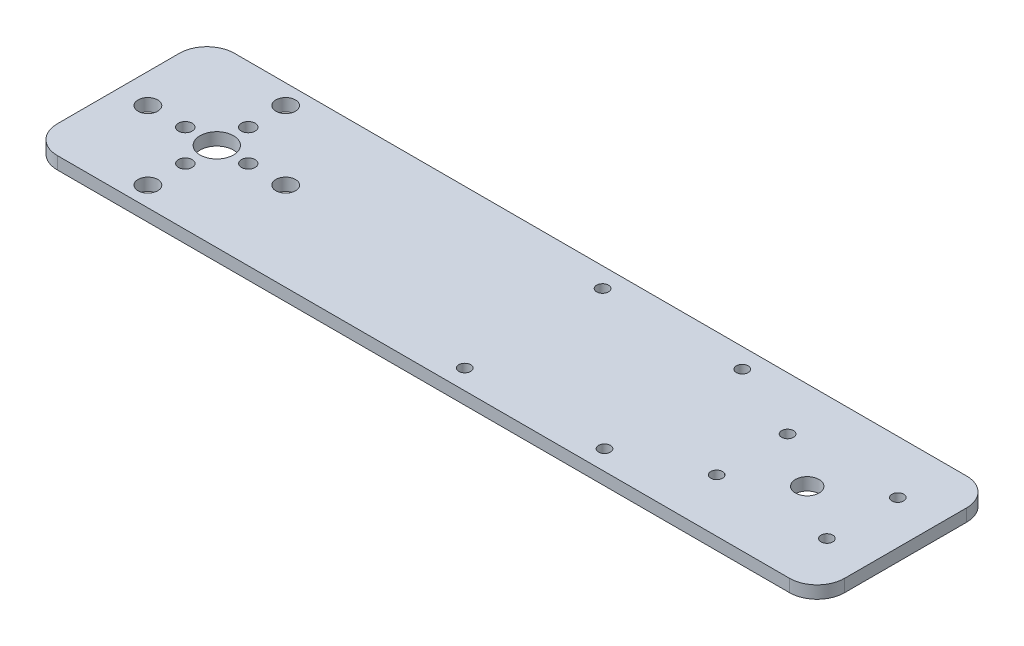
from build123d import *

# Parameters (mm, degrees)
SKETCH1_W           = 200
SKETCH1_H           = 45
BOSS_EXTRUDE1_DEPTH = 3.175
SKETCH4_R           = 3
SKETCH4_R_2         = 1.5
CUT_EXTRUDE1_DEPTH  = 177.469064215
SKETCH5_R           = 4.25
CUT_EXTRUDE2_DEPTH  = 177.469064215
SKETCH10_R          = 1.5
CUT_EXTRUDE4_DEPTH  = 177.469064215
FILLET1_R           = 7
SKETCH11_R          = 2.5
CUT_EXTRUDE5_DEPTH  = 177.469064215
SKETCH12_R          = 1.75
CUT_EXTRUDE6_DEPTH  = 177.469064215


with BuildPart() as part:
    # Sketch1 → Boss-Extrude1 (new body)
    with BuildSketch(Plane(origin=(0, 0, 0), x_dir=(1, 0, 0), z_dir=(0, 1, 0))):
        with Locations((75, 0)):
            Rectangle(SKETCH1_W, SKETCH1_H)
    extrude(amount=BOSS_EXTRUDE1_DEPTH)

    # Sketch4 → Cut-Extrude1 (cut, through all)
    with BuildSketch(Plane(origin=(0, 3.175, 0), x_dir=(1, 0, 0), z_dir=(0, 1, 0))):
        with Locations(Location((150, 0, 0), (0, 0, 270))):
            Circle(SKETCH4_R)
        with Locations(Location((136, 9, 0), (0, 0, 270))):
            Circle(SKETCH4_R_2)
        with Locations(Location((164, 9, 0), (0, 0, 90))):
            Circle(SKETCH4_R_2)
        with Locations(Location((164, -9, 0), (0, 0, 270))):
            Circle(SKETCH4_R_2)
        with Locations(Location((136, -9, 0), (0, 0, 90))):
            Circle(SKETCH4_R_2)
    extrude(amount=-CUT_EXTRUDE1_DEPTH, mode=Mode.SUBTRACT)

    # Sketch5 → Cut-Extrude2 (cut, through all)
    with BuildSketch(Plane(origin=(0, 3.175, 0), x_dir=(1, 0, 0), z_dir=(0, 1, 0))):
        with Locations(Location((0, 0, 0), (0, 0, 270))):
            Circle(SKETCH5_R)
    extrude(amount=-CUT_EXTRUDE2_DEPTH, mode=Mode.SUBTRACT)

    # Sketch10 → Cut-Extrude4 (cut, through all)
    with BuildSketch(Plane(origin=(0, 3.175, 0), x_dir=(1, 0, 0), z_dir=(0, 1, 0))):
        with Locations(Location((80.5, -17.5, 0), (0, 0, 270))):
            Circle(SKETCH10_R)
        with Locations(Location((116, -17.5, 0), (0, 0, 270))):
            Circle(SKETCH10_R)
        with Locations(Location((116, 17.5, 0), (0, 0, 90))):
            Circle(SKETCH10_R)
        with Locations(Location((80.5, 17.5, 0), (0, 0, 90))):
            Circle(SKETCH10_R)
    extrude(amount=-CUT_EXTRUDE4_DEPTH, mode=Mode.SUBTRACT)

    # Fillet1
    fillet1_edges = [part.edges().sort_by_distance(p)[0] for p in [
        (-25, 1.5875, -22.5),
        (175, 1.5875, -22.5),
        (175, 1.5875, 22.5),
        (-25, 1.5875, 22.5),
    ]]
    fillet(fillet1_edges, radius=FILLET1_R)

    # Sketch11 → Cut-Extrude5 (cut, through all)
    with BuildSketch(Plane(origin=(0, 3.175, 0), x_dir=(1, 0, 0), z_dir=(0, 1, 0))):
        with Locations(Location((0, 17.5, 0), (0, 0, 270))):
            Circle(SKETCH11_R)
        with Locations(Location((17.5, 0, 0), (0, 0, 270))):
            Circle(SKETCH11_R)
        with Locations(Location((0, -17.5, 0), (0, 0, 270))):
            Circle(SKETCH11_R)
        with Locations(Location((-17.5, 0, 0), (0, 0, 270))):
            Circle(SKETCH11_R)
    extrude(amount=-CUT_EXTRUDE5_DEPTH, mode=Mode.SUBTRACT)

    # Sketch12 → Cut-Extrude6 (cut, through all)
    with BuildSketch(Plane(origin=(0, 3.175, 0), x_dir=(1, 0, 0), z_dir=(0, 1, 0))):
        with Locations(Location((0, 8, 0), (0, 0, 270))):
            Circle(SKETCH12_R)
        with Locations(Location((8, 0, 0), (0, 0, 270))):
            Circle(SKETCH12_R)
        with Locations(Location((0, -8, 0), (0, 0, 270))):
            Circle(SKETCH12_R)
        with Locations(Location((-8, 0, 0), (0, 0, 270))):
            Circle(SKETCH12_R)
    extrude(amount=-CUT_EXTRUDE6_DEPTH, mode=Mode.SUBTRACT)


solid = part.part
